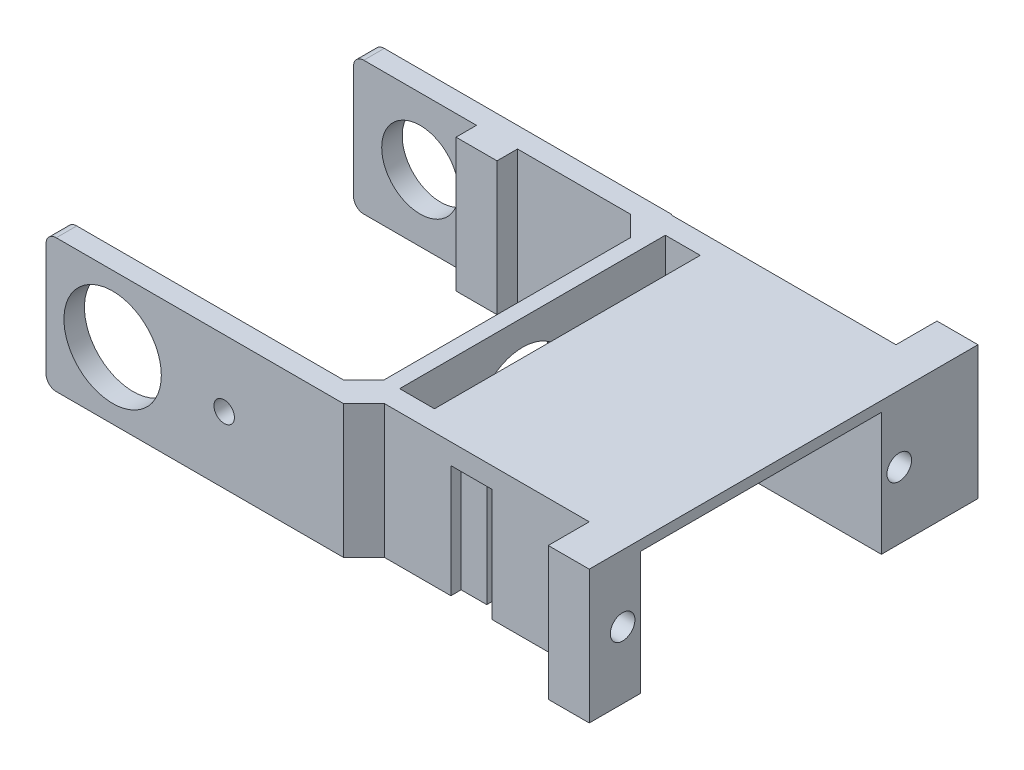
from build123d import *

# Parameters (mm, degrees)
BOSS_EXTRUDE1_DEPTH = 65
FILLET1_R           = 5
SKETCH2_R           = 18.75
CUT_EXTRUDE1_DEPTH  = 80
SKETCH3_R           = 23.75
CUT_EXTRUDE2_DEPTH  = 10
BOSS_EXTRUDE2_DEPTH = 65
SKETCH5_W           = 17
SKETCH5_H           = 129.632645568
CUT_EXTRUDE3_DEPTH  = 65
SKETCH6_W           = 75
SKETCH6_H           = 117.5
CUT_EXTRUDE4_DEPTH  = 60
SKETCH7_W           = 20
SKETCH7_H           = 65
BOSS_EXTRUDE3_DEPTH = 20
SKETCH8_R           = 6
CUT_EXTRUDE6_DEPTH  = 20
SKETCH9_W           = 20
SKETCH9_H           = 55
CUT_EXTRUDE8_DEPTH  = 5
SKETCH10_R          = 22.5
CUT_EXTRUDE9_DEPTH  = 7.5
SKETCH11_W          = 20
SKETCH11_H          = 10
BOSS_EXTRUDE4_DEPTH = 65
SKETCH12_R          = 5
CUT_EXTRUDE10_DEPTH = 10


with BuildPart() as part:
    # Sketch1 → Boss-Extrude1 (new body)
    with BuildSketch(Plane(origin=(0, 0, 0), x_dir=(1, 0, 0), z_dir=(0, 1, 0))):
        Polygon((0, 70), (0, -70), (-10, -80), (-155, -80), (-155, -70), (-20, -70), (-10, -60), (-10, 60), (-20, 70), (-155, 70), (-155, 80), (-10, 80), align=None)
    extrude(amount=BOSS_EXTRUDE1_DEPTH)

    # Fillet1
    fillet1_edges = [part.edges().sort_by_distance(p)[0] for p in [
        (-155, 65, 75),
        (-155, 0, -75),
        (-155, 0, 75),
        (-155, 65, -75),
    ]]
    fillet(fillet1_edges, radius=FILLET1_R)

    # Sketch2 → Cut-Extrude1 (cut)
    with BuildSketch(Plane.XY):
        with Locations((-122.5, 32.5)):
            Circle(SKETCH2_R)
    extrude(amount=-CUT_EXTRUDE1_DEPTH, mode=Mode.SUBTRACT)

    # Sketch3 → Cut-Extrude2 (cut)
    with BuildSketch(Plane.XY.offset(80)):
        with Locations((-122.5, 32.5)):
            Circle(SKETCH3_R)
    extrude(amount=-CUT_EXTRUDE2_DEPTH, mode=Mode.SUBTRACT)

    # Sketch4 → Boss-Extrude2 (add)
    with BuildSketch(Plane(origin=(0, 0, 0), x_dir=(1, 0, 0), z_dir=(0, 1, 0))):
        Polygon((-9.632645568, 79.632645568), (120, 79.632645568), (120, -70), (0, -70), (0, 70), align=None)
    extrude(amount=BOSS_EXTRUDE2_DEPTH)

    # Sketch5 → Cut-Extrude3 (cut)
    with BuildSketch(Plane.XZ):
        with Locations((6, -4.816322784)):
            Rectangle(SKETCH5_W, SKETCH5_H)
    extrude(amount=-CUT_EXTRUDE3_DEPTH, mode=Mode.SUBTRACT)

    # Sketch6 → Cut-Extrude4 (cut)
    with BuildSketch(Plane.XZ):
        with Locations((82.5, 6.25)):
            Rectangle(SKETCH6_W, SKETCH6_H)
    extrude(amount=-CUT_EXTRUDE4_DEPTH, mode=Mode.SUBTRACT)

    # Sketch7 → Boss-Extrude3 (add)
    with BuildSketch(Plane(origin=(120, 0, 0), x_dir=(0, 0, -1), z_dir=(1, 0, 0))):
        with Locations((-80, 32.5)):
            Rectangle(SKETCH7_W, SKETCH7_H)
        with Locations((89.632645568, 32.5)):
            Rectangle(SKETCH7_W, SKETCH7_H)
    extrude(amount=-BOSS_EXTRUDE3_DEPTH)

    # Sketch8 → Cut-Extrude6 (cut)
    with BuildSketch(Plane(origin=(120, 0, 0), x_dir=(0, 0, -1), z_dir=(1, 0, 0))):
        with Locations((-73.725, 32.5)):
            Circle(SKETCH8_R)
        with Locations((61.225, 32.5)):
            Circle(SKETCH8_R)
    extrude(amount=-CUT_EXTRUDE6_DEPTH, mode=Mode.SUBTRACT)

    # Sketch9 → Cut-Extrude8 (cut)
    with BuildSketch(Plane.XY.offset(70)):
        with Locations((42.5, 27.5)):
            Rectangle(SKETCH9_W, SKETCH9_H)
    extrude(amount=-CUT_EXTRUDE8_DEPTH, mode=Mode.SUBTRACT)

    # Sketch10 → Cut-Extrude9 (cut)
    with BuildSketch(Plane.ZY.offset(10)):
        with Locations((0, 30)):
            Circle(SKETCH10_R)
    extrude(amount=-CUT_EXTRUDE9_DEPTH, mode=Mode.SUBTRACT)

    # Sketch11 → Boss-Extrude4 (add)
    with BuildSketch(Plane(origin=(0, 0, 0), x_dir=(1, 0, 0), z_dir=(0, 1, 0))):
        with Locations((-85, 65)):
            Rectangle(SKETCH11_W, SKETCH11_H)
    extrude(amount=BOSS_EXTRUDE4_DEPTH)

    # Sketch12 → Cut-Extrude10 (cut)
    with BuildSketch(Plane.XY.offset(80)):
        with Locations((-68.08, 32.5)):
            Circle(SKETCH12_R)
    extrude(amount=-CUT_EXTRUDE10_DEPTH, mode=Mode.SUBTRACT)


solid = part.part
